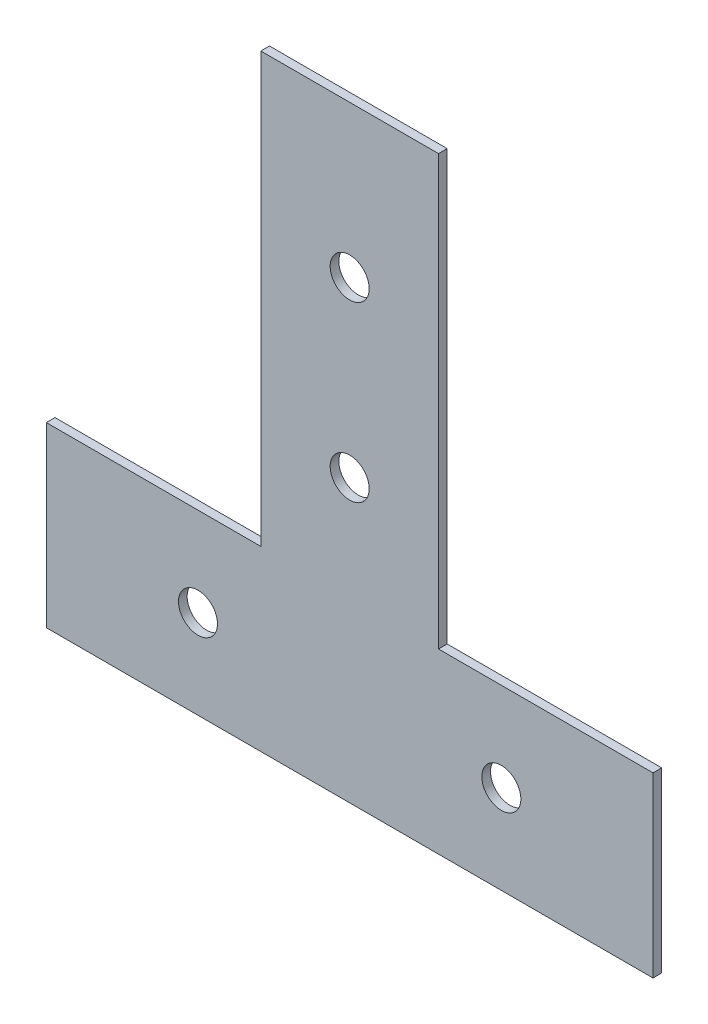
from build123d import *

# Parameters (mm, degrees)
EXTRUDE_1_DEPTH     = 2
SKETCH_2_R          = 4.5
CUT_EXTRUDE_1_DEPTH = 139.507220028


with BuildPart() as part:
    # 草图1 → 凸台-拉伸1 (new body)
    with BuildSketch(Plane.XY):
        Polygon((-70, -20.5), (70, -20.5), (70, 20.5), (20.5, 20.5), (20.5, 119.5), (-20.5, 119.5), (-20.5, 20.5), (-70, 20.5), align=None)
    extrude(amount=EXTRUDE_1_DEPTH)

    # 草图2 → 切除-拉伸1 (cut, through all)
    with BuildSketch(Plane.XY.offset(2)):
        with Locations((0, 84.5)):
            Circle(SKETCH_2_R)
        with Locations((0, 44.5)):
            Circle(SKETCH_2_R)
        with Locations((-35, 0)):
            Circle(SKETCH_2_R)
        with Locations(Location((35, 0, 0), (0, 0, 180))):
            Circle(SKETCH_2_R)
    extrude(amount=-CUT_EXTRUDE_1_DEPTH, mode=Mode.SUBTRACT)


solid = part.part
